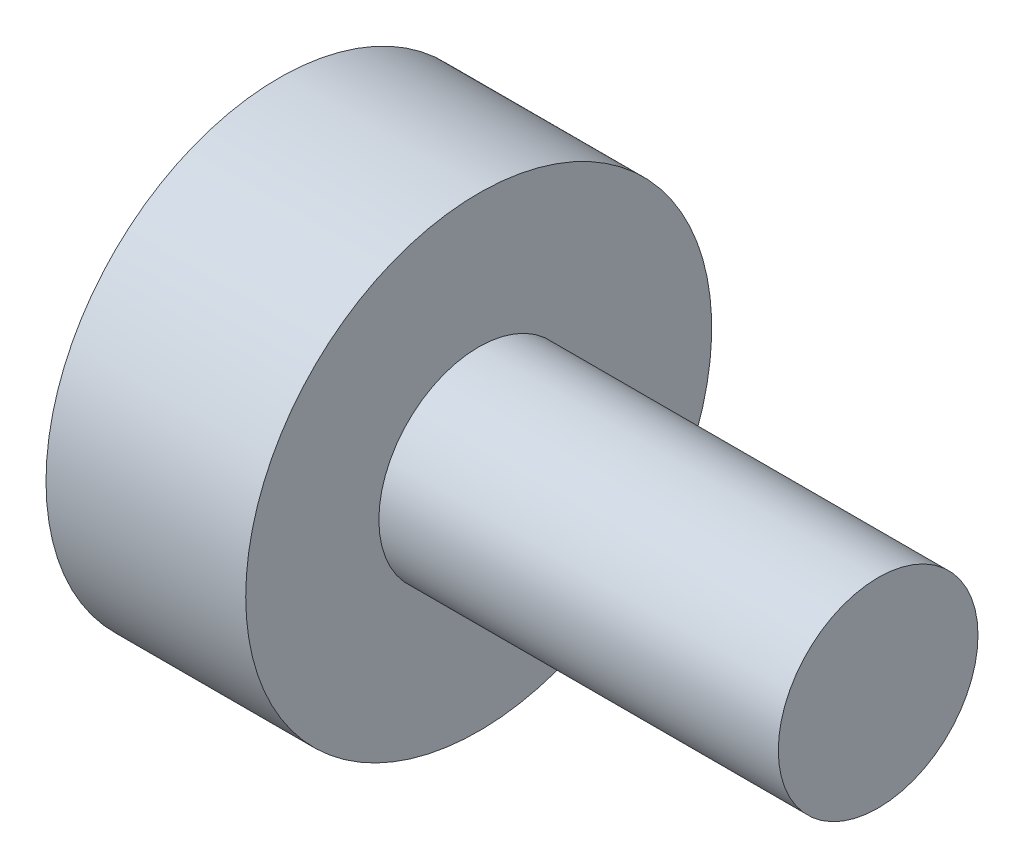
from build123d import *

# Parameters (mm, degrees)
SKETCH_2_R          = 5
CUT_EXTRUDE_1_DEPTH = 20


with BuildPart() as part:
    # Эскиз1 → Повернуть1 (revolve)
    with BuildSketch(Plane.XY, mode=Mode.PRIVATE) as revolve_1_sk:
        Polygon((0, 0), (100, 0), (100, 15), (40, 15), (40, 35), (10, 35), (10, 20), (0, 20), align=None)
    revolve(revolve_1_sk.sketch.rotate(Axis((0, 0, 0), (1, 0, 0)), 90), axis=Axis((0, 0, 0), (1, 0, 0)))

    # Эскиз2 → Вырез-Вытянуть1 (cut)
    with BuildSketch(Plane(origin=(0, 0, 0), x_dir=(0, 0, -1), z_dir=(1, 0, 0))):
        with Locations((0, 10)):
            Circle(SKETCH_2_R)
    extrude(amount=CUT_EXTRUDE_1_DEPTH, mode=Mode.SUBTRACT)


solid = part.part
